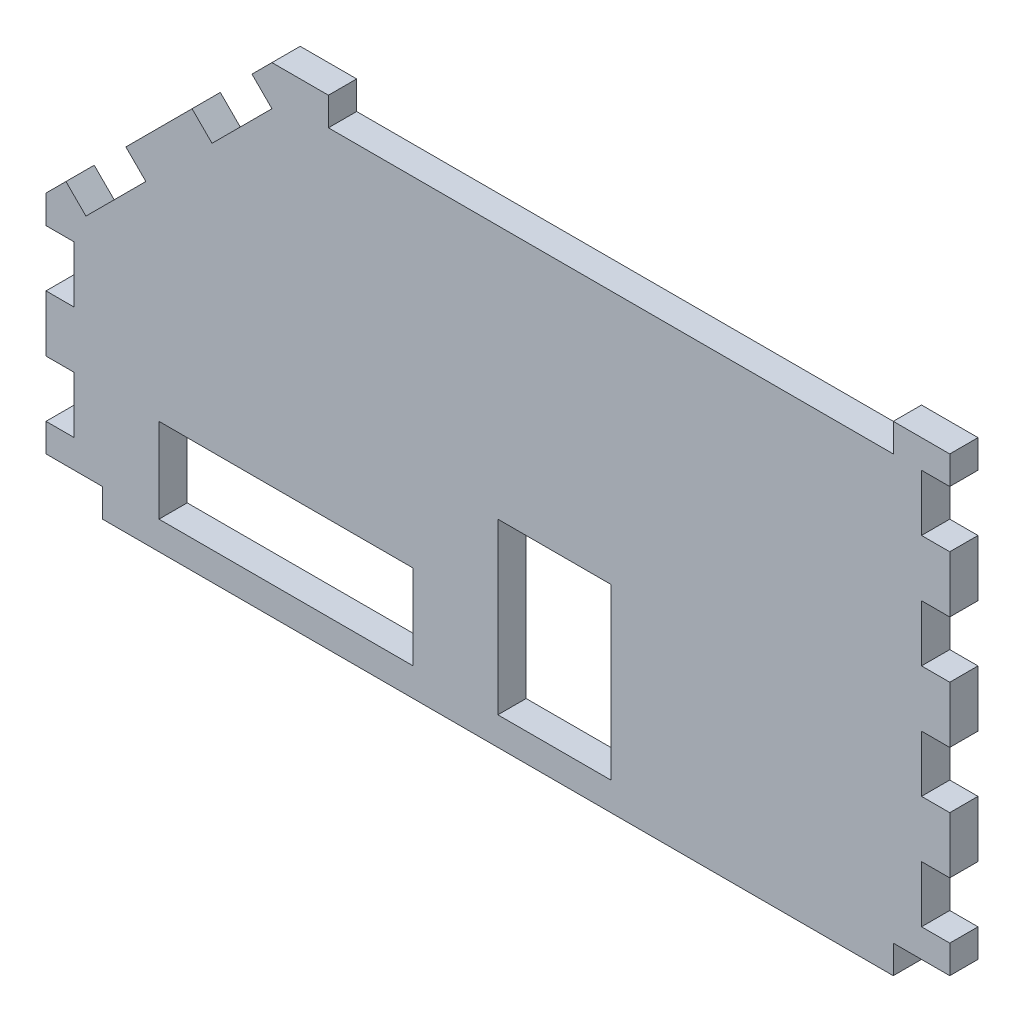
from build123d import *

# Parameters (mm, degrees)
BOSS_EXTRU_1_DEPTH      = 5
ESQUISSE2_W             = 5
ESQUISSE2_H             = 10
ENL_V_MAT_EXTRU_1_DEPTH = 10
ENL_V_MAT_EXTRU_2_DEPTH = 10
ESQUISSE4_W             = 45
ESQUISSE4_H             = 15
ESQUISSE4_W_2           = 20
ESQUISSE4_H_2           = 30
ENL_V_MAT_EXTRU_3_DEPTH = 10


with BuildPart() as part:
    # Esquisse1 → Boss.-Extru.1 (new body)
    with BuildSketch(Plane.XY):
        Polygon((-80, 0), (-40, 40), (-30, 40), (-30, 35), (70, 35), (70, 40), (80, 40), (80, -40), (70, -40), (70, -45), (-70, -45), (-70, -40), (-80, -40), (-80, -35), (-75, -35), (-75, -25), (-80, -25), (-80, -15), (-75, -15), (-75, -5), (-80, -5), align=None)
    extrude(amount=BOSS_EXTRU_1_DEPTH)

    # Esquisse2 → Enlèv. mat.-Extru.1 (cut)
    with BuildSketch(Plane.XY.offset(5)):
        with Locations((77.5, -30)):
            Rectangle(ESQUISSE2_W, ESQUISSE2_H)
        with Locations((77.5, -10)):
            Rectangle(ESQUISSE2_W, ESQUISSE2_H)
        with Locations((77.5, 10)):
            Rectangle(ESQUISSE2_W, ESQUISSE2_H)
        with Locations((77.5, 30)):
            Rectangle(ESQUISSE2_W, ESQUISSE2_H)
    extrude(amount=-ENL_V_MAT_EXTRU_1_DEPTH, mode=Mode.SUBTRACT)

    # Esquisse3 → Enlèv. mat.-Extru.2 (cut)
    with BuildSketch(Plane.XY.offset(5)):
        Polygon((-43.535533906, 36.464466094), (-54.142135624, 25.857864376), (-50.606601718, 22.32233047), (-40, 32.928932188), align=None)
        Polygon((-65.857864376, 14.142135624), (-76.464466094, 3.535533906), (-72.928932188, 0), (-62.32233047, 10.606601718), align=None)
    extrude(amount=-ENL_V_MAT_EXTRU_2_DEPTH, mode=Mode.SUBTRACT)

    # Esquisse4 → Enlèv. mat.-Extru.3 (cut)
    with BuildSketch(Plane.XY.offset(5)):
        with Locations((-37.5, -32.5)):
            Rectangle(ESQUISSE4_W, ESQUISSE4_H)
        with Locations((10, -25)):
            Rectangle(ESQUISSE4_W_2, ESQUISSE4_H_2)
    extrude(amount=-ENL_V_MAT_EXTRU_3_DEPTH, mode=Mode.SUBTRACT)


solid = part.part
